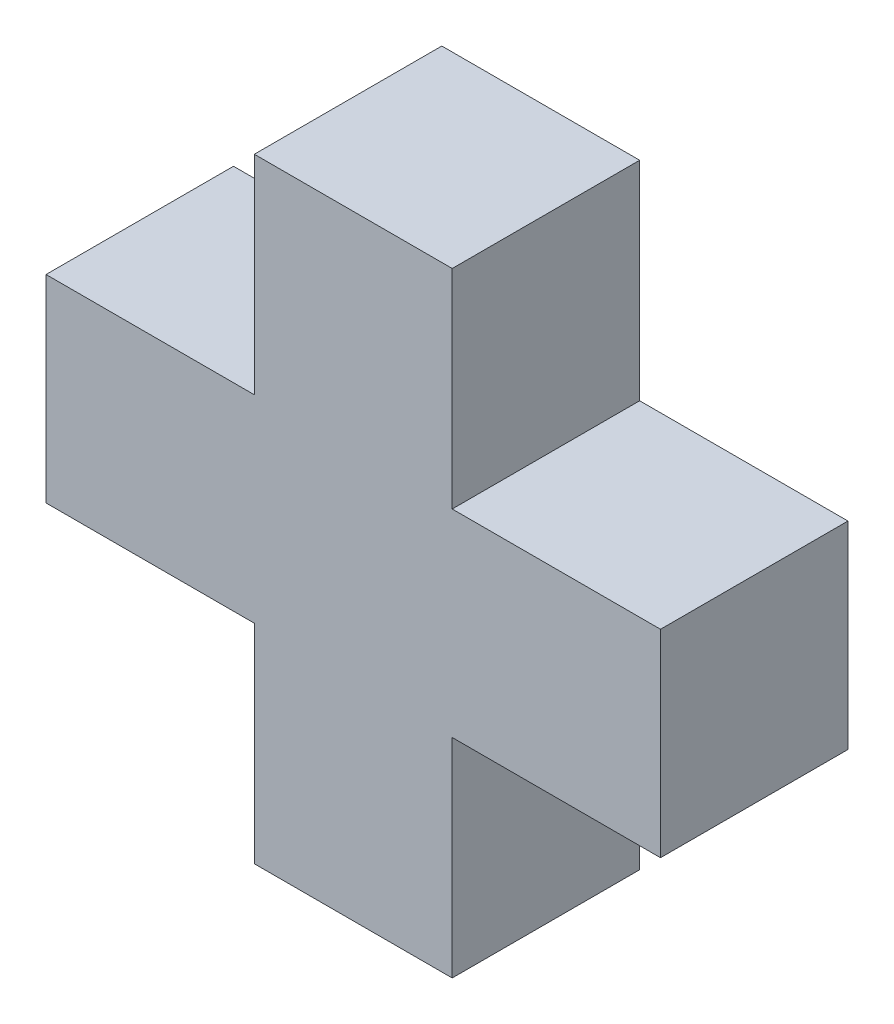
from build123d import *

# Parameters (mm, degrees)
BOSS_EXTRUDE2_DEPTH = 9


with BuildPart() as part:
    # Sketch1 → Boss-Extrude2 (new body)
    with BuildSketch(Plane.XY):
        Polygon((-4.75, -14.75), (4.75, -14.75), (4.75, -4.75), (14.75, -4.75), (14.75, 4.75), (4.75, 4.75), (4.75, 14.75), (-4.75, 14.75), (-4.75, 4.75), (-14.75, 4.75), (-14.75, -4.75), (-4.75, -4.75), align=None)
    extrude(amount=BOSS_EXTRUDE2_DEPTH)


solid = part.part
